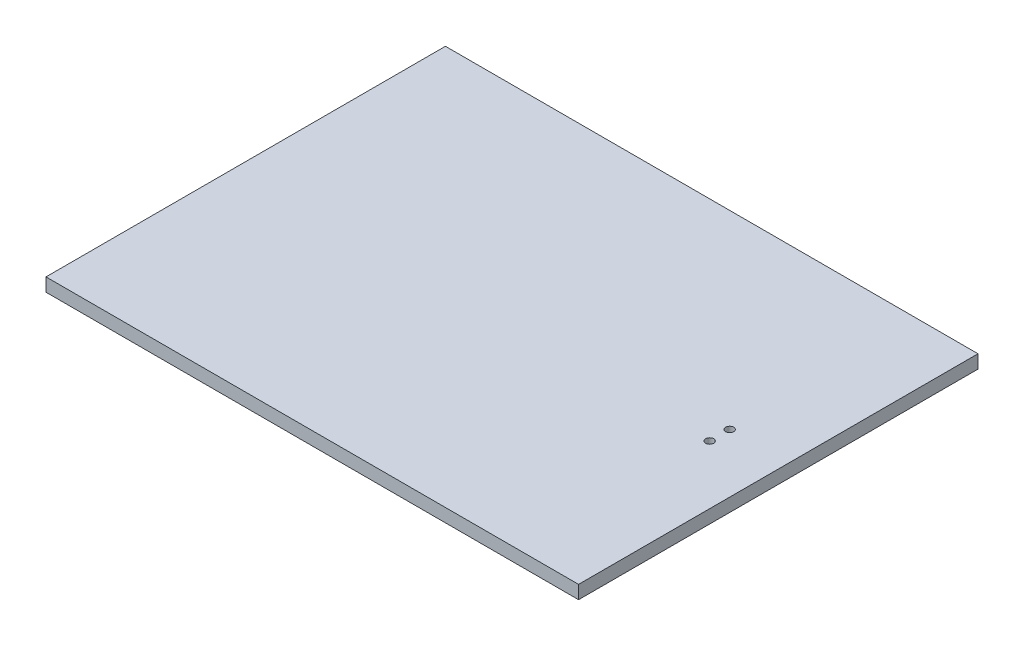
from build123d import *

# Parameters (mm, degrees)
BASE_PLATE_SKETCH_W = 400
BASE_PLATE_SKETCH_H = 300
BASE_PLATE_SKETCH_R = 3
BOSS_EXTRUDE1_DEPTH = 10


with BuildPart() as part:
    # base_plate_sketch → Boss-Extrude1 (new body)
    with BuildSketch(Plane(origin=(0, 0, 0), x_dir=(1, 0, 0), z_dir=(0, 1, 0))):
        Rectangle(BASE_PLATE_SKETCH_W, BASE_PLATE_SKETCH_H)
        with Locations(Location((156, 7.5, 0), (0, 0, 270))):
            Circle(BASE_PLATE_SKETCH_R, mode=Mode.SUBTRACT)
        with Locations(Location((156, -7.5, 0), (0, 0, 270))):
            Circle(BASE_PLATE_SKETCH_R, mode=Mode.SUBTRACT)
    extrude(amount=BOSS_EXTRUDE1_DEPTH)


solid = part.part
